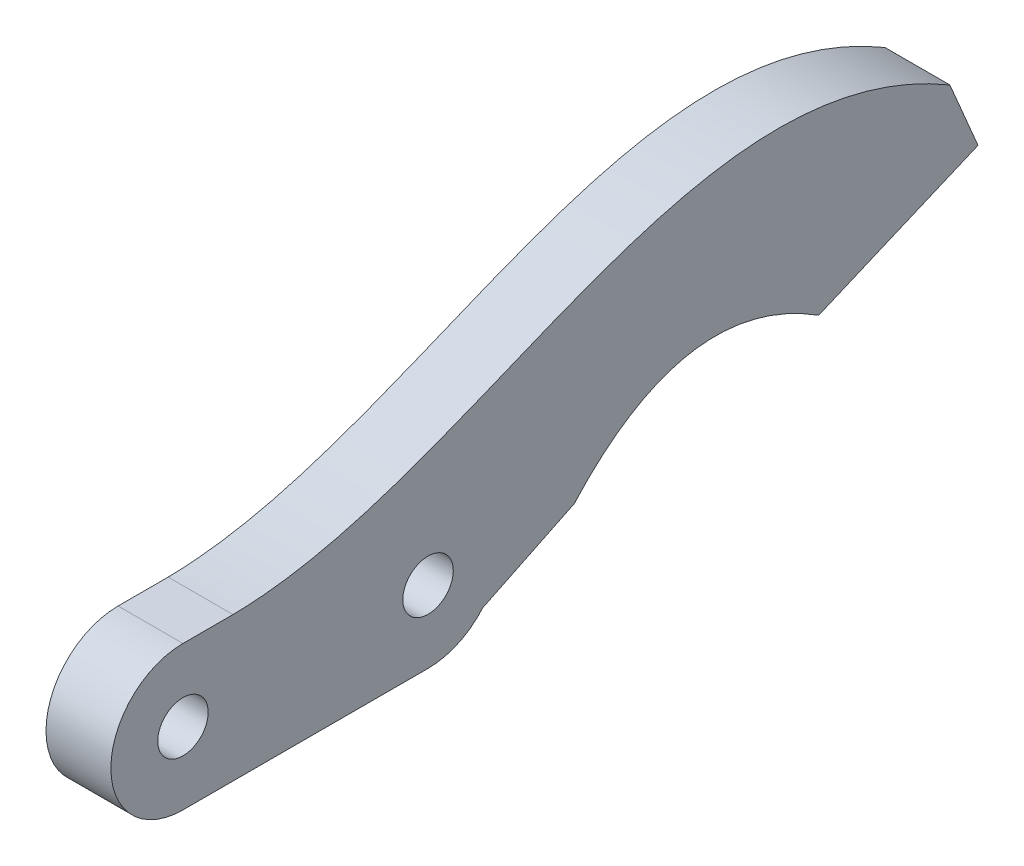
from build123d import *

# Parameters (mm, degrees)
SKETCH1_R           = 1.75
BOSS_EXTRUDE1_DEPTH = 4.5
BOSS_EXTRUDE2_DEPTH = 4.5


with BuildPart() as part:
    # Sketch1 → Boss-Extrude1 (new body)
    with BuildSketch(Plane(origin=(0, 0, 0), x_dir=(0, 0, -1), z_dir=(1, 0, 0))):
        with BuildLine():
            Line((22, 10), (5, 10))
            ThreePointArc((5, 10), (0, 5), (5, 0))
            Line((5, 0), (22, 0))
            ThreePointArc((22, 0), (27, 5), (22, 10))
        make_face()
        with Locations((5, 5)):
            Circle(SKETCH1_R, mode=Mode.SUBTRACT)
        with Locations((22, 5)):
            Circle(SKETCH1_R, mode=Mode.SUBTRACT)
    extrude(amount=BOSS_EXTRUDE1_DEPTH)

    # Sketch2 → Boss-Extrude2 (add)
    with BuildSketch(Plane(origin=(4.5, 0, 5.948752288), x_dir=(0, 0, -1), z_dir=(1, 0, 0))):
        with BuildLine():
            add(Edge.make_bspline(
                [(64.143181637, 16.951696957), (46.3659084, 27.475135201), (31.177283873, 9.75391621), (13.694974759, 10)],
                knots=[0, 0, 0, 0, 1, 1, 1, 1], degree=3))
            Line((13.694974759, 10), (26.999543269, 9.812722758))
            ThreePointArc((26.999543269, 9.812722758), (31.550747241, 5.770381866), (28.824655416, 0.327735373))
            Line((28.824655416, 0.327735373), (38.08542066, 4.824084077))
            add(Edge.make_bspline(
                [(38.08542066, 4.824084077), (45.879227883, 13.481709162), (55.04551447, 7.665553941)],
                knots=[0, 0, 0, 1, 1, 1], degree=2))
            Line((55.04551447, 7.665553941), (66.094228393, 12.348066156))
            Line((66.094228393, 12.348066156), (64.143181637, 16.951696957))
        make_face()
    extrude(amount=-BOSS_EXTRUDE2_DEPTH)


solid = part.part
